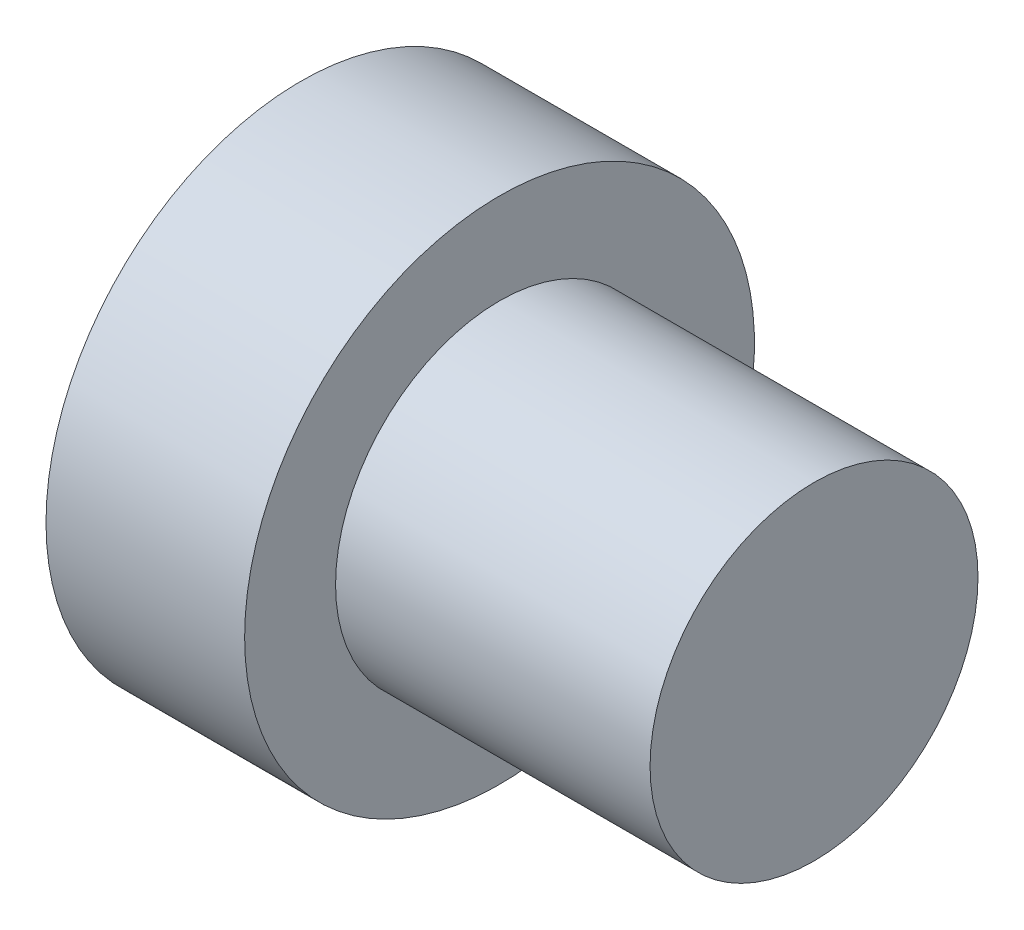
from build123d import *


with BuildPart() as part:
    # Plug_ORB4 Sketch → Plug_ORB4 (revolve)
    with BuildSketch(Plane.XY):
        Polygon((9.5, 0), (9.5, 4.953), (0, 4.953), (0, 7.7), (-6, 7.7), (-6, 0), align=None)
    revolve(axis=Axis((-1000, 0, 0), (1, 0, 0)))


solid = part.part
